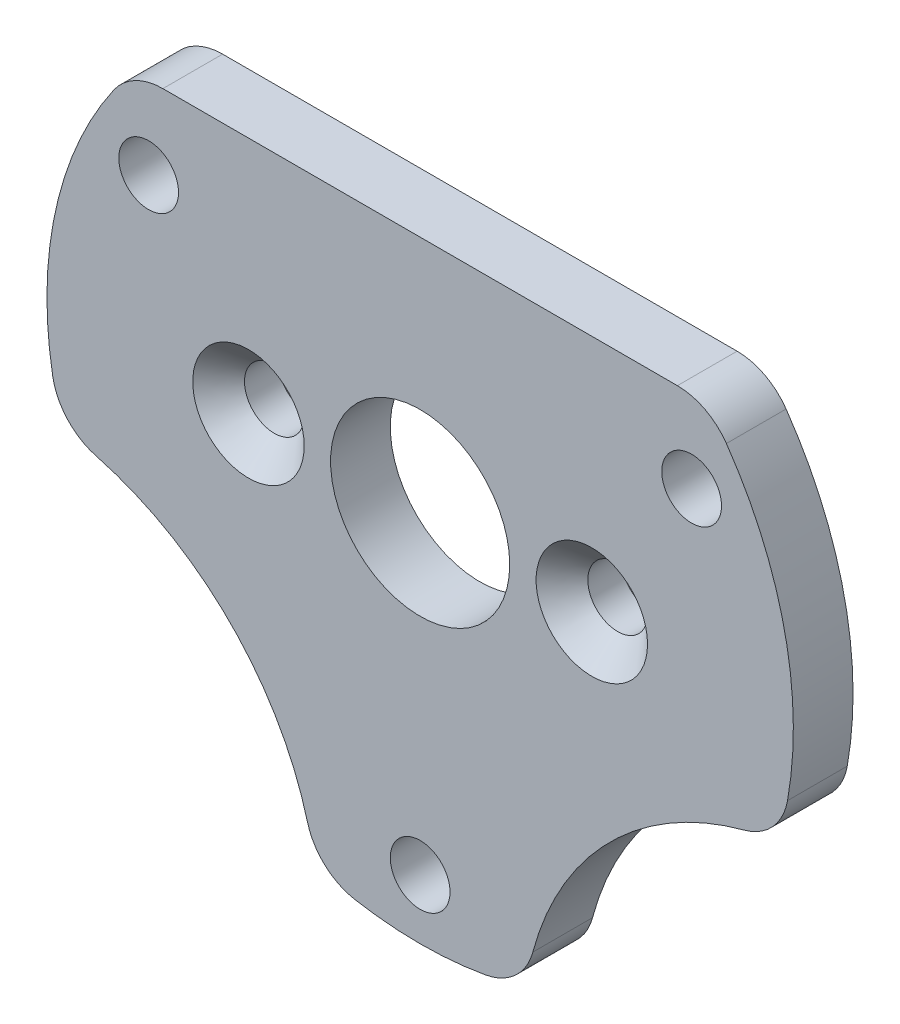
from build123d import *

# Parameters (mm, degrees)
SKETCH_1_R          = 1
SKETCH_1_R_2        = 3
EXTRUDE_1_DEPTH     = 2
CUT_EXTRUDE_START   = -10
CUT_EXTRUDE_1_DEPTH = 10
FILLET_1_R          = 2
CHAMFER_1_SIZE      = 0.866


with BuildPart() as part:
    # 草图1 → 凸台-拉伸1 (new body)
    with BuildSketch(Plane.XY):
        with BuildLine():
            Line((-9.604686356, 8), (9.604686356, 8))
            ThreePointArc((9.604686356, 8), (0, -12.5), (-9.604686356, 8))
        make_face()
        with Locations((0, -10.5)):
            Circle(SKETCH_1_R, mode=Mode.SUBTRACT)
        with Locations((-9.09326674, 5.25)):
            Circle(SKETCH_1_R, mode=Mode.SUBTRACT)
        with Locations((9.09326674, 5.25)):
            Circle(SKETCH_1_R, mode=Mode.SUBTRACT)
        with Locations((-5.75, 0)):
            Circle(SKETCH_1_R, mode=Mode.SUBTRACT)
        with Locations(Location((5.75, 0, 0), (0, 0, 180))):
            Circle(SKETCH_1_R, mode=Mode.SUBTRACT)
        Circle(SKETCH_1_R_2, mode=Mode.SUBTRACT)
    extrude(amount=EXTRUDE_1_DEPTH)

    # 草图2 → 切除-拉伸1 (cut)
    with BuildSketch(Plane.XY.offset(2).offset(CUT_EXTRUDE_START)):
        with BuildLine():
            ThreePointArc((-11.98818711, -3.540249967), (-6.363961031, -6.363961031), (-3.540249967, -11.98818711))
            ThreePointArc((-3.540249967, -11.98818711), (-8.838834765, -8.838834765), (-11.98818711, -3.540249967))
        make_face()
        with BuildLine():
            ThreePointArc((11.98818711, -3.540249967), (6.363961031, -6.363961031), (3.540249967, -11.98818711))
            ThreePointArc((3.540249967, -11.98818711), (8.838834765, -8.838834765), (11.98818711, -3.540249967))
        make_face()
    extrude(amount=CUT_EXTRUDE_1_DEPTH, mode=Mode.SUBTRACT)

    # 圆角1
    fillet_1_edges = [part.edges().sort_by_distance(p)[0] for p in [
        (-3.540249967, -11.98818711, 1),
        (-11.98818711, -3.540249967, 1),
        (-9.604686356, 8, 1),
        (11.98818711, -3.540249967, 1),
        (9.604686356, 8, 1),
        (3.540249967, -11.98818711, 1),
    ]]
    fillet(fillet_1_edges, radius=FILLET_1_R)

    # 倒角1
    chamfer_1_edges = [part.edges().sort_by_distance(p)[0] for p in [
        (-6.75, 0, 2),
        (6.75, 0, 2),
    ]]
    chamfer(chamfer_1_edges, length=CHAMFER_1_SIZE)


solid = part.part
